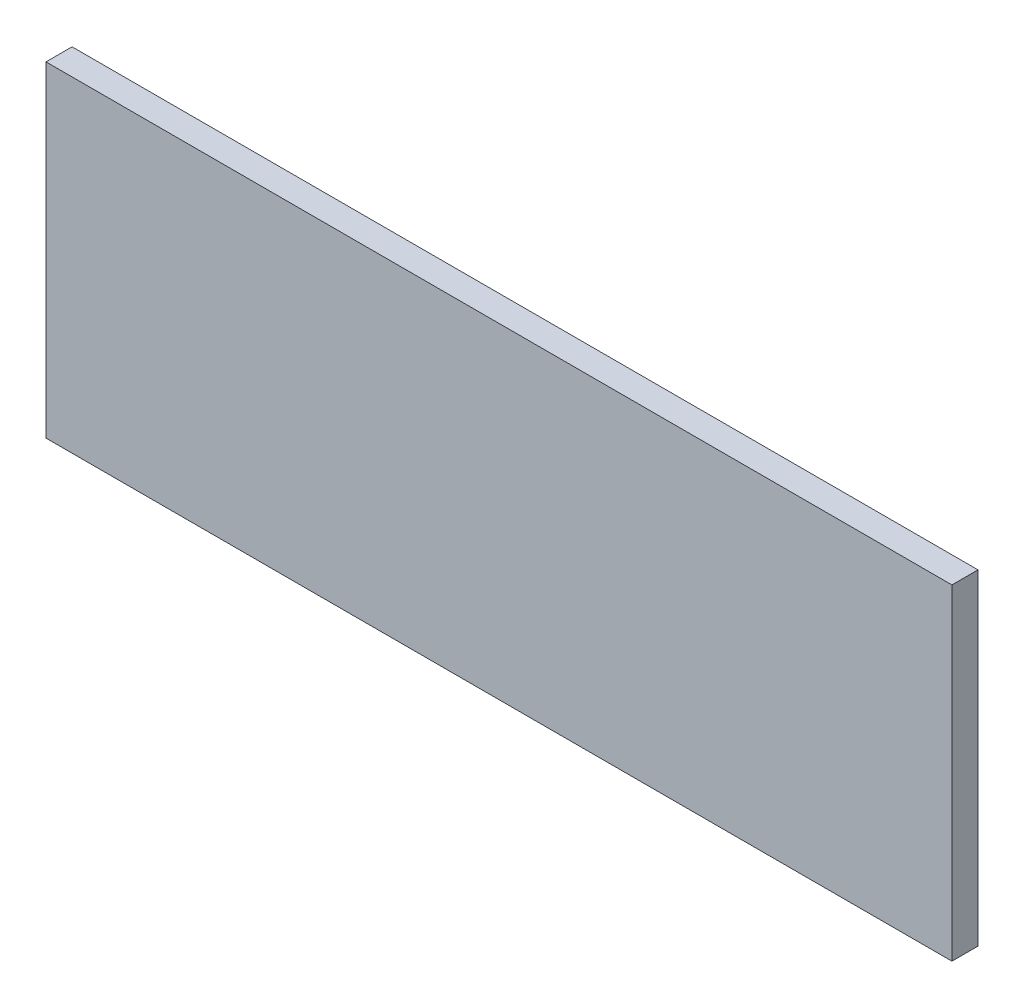
from build123d import *

# Parameters (mm, degrees)
CROQUIS1_W              = 139
CROQUIS1_H              = 50
SALIENTE_EXTRUIR1_DEPTH = 4


with BuildPart() as part:
    # Croquis1 → Saliente-Extruir1 (new body)
    with BuildSketch(Plane.XY):
        with Locations((69.5, -25)):
            Rectangle(CROQUIS1_W, CROQUIS1_H)
    extrude(amount=SALIENTE_EXTRUIR1_DEPTH)


solid = part.part
